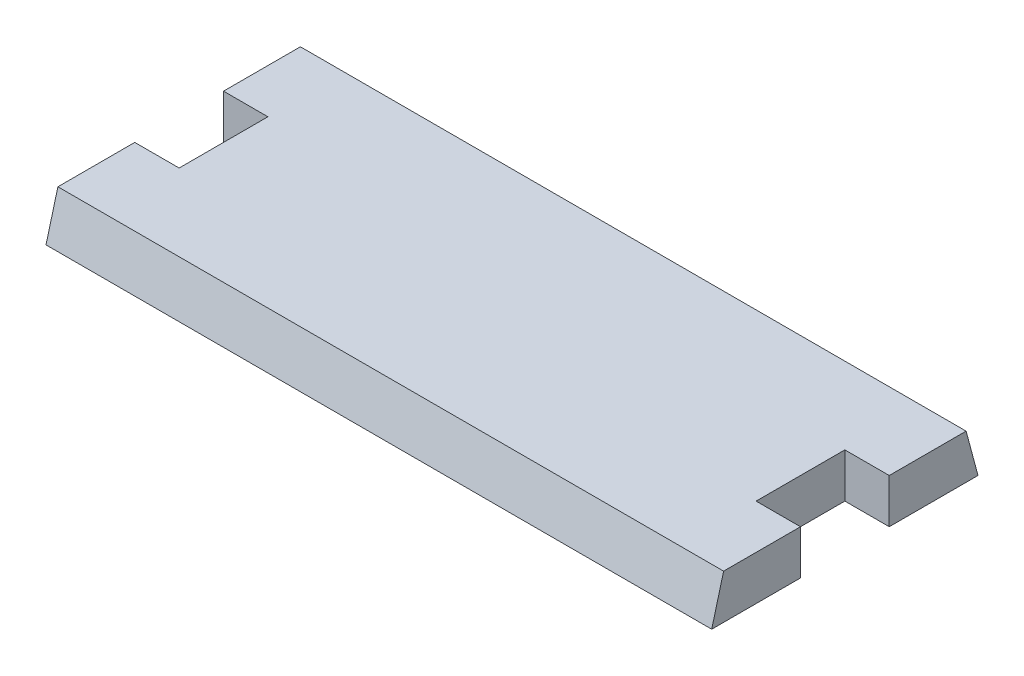
from build123d import *

# Parameters (mm, degrees)
BOSS_EXTRUDE2_DEPTH = 10
DRAFT2_ANGLE        = -15


with BuildPart() as part:
    # Sketch1 → Boss-Extrude2 (new body)
    with BuildSketch(Plane(origin=(0, 0, 0), x_dir=(1, 0, 0), z_dir=(0, 1, 0))):
        Polygon((75, 10), (75, 30), (-75, 30), (-75, 10), (-65, 10), (-65, -10), (-75, -10), (-75, -30), (75, -30), (75, -10), (65, -10), (65, 10), align=None)
    extrude(amount=BOSS_EXTRUDE2_DEPTH)

    # Draft2
    draft2_faces = [part.faces().sort_by_distance(p)[0] for p in [
        (0, 5, -30),
        (0, 5, 30),
    ]]
    draft(draft2_faces, Plane(origin=(0, 0, 0), x_dir=(0, 0, -1), z_dir=(0, -1, 0)), DRAFT2_ANGLE)


solid = part.part
